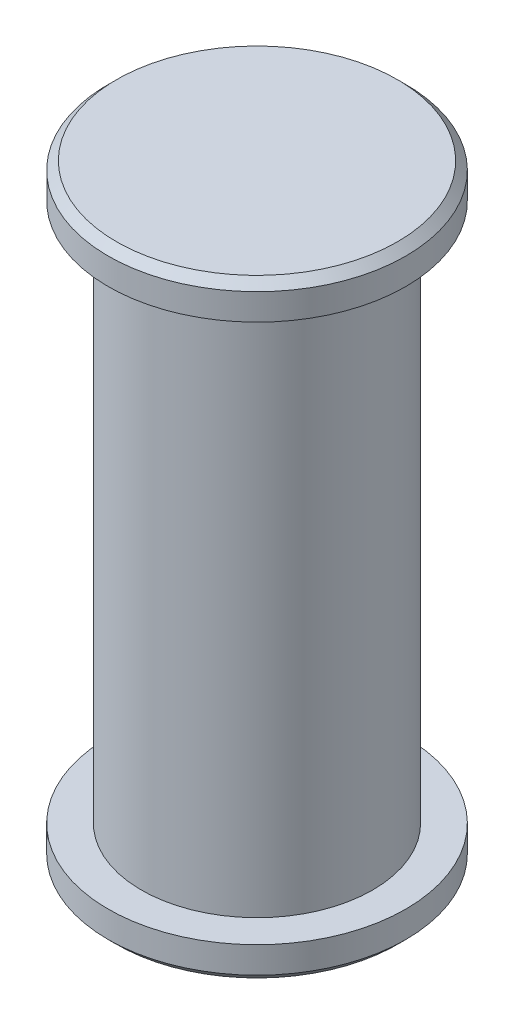
from build123d import *

# Parameters (mm, degrees)
CHAMFER1_SIZE = 0.25


with BuildPart() as part:
    # Sketch1 → Revolve1 (revolve)
    with BuildSketch(Plane.XY, mode=Mode.PRIVATE) as revolve1_sk:
        Polygon((0, 18.407826487), (-4.5, 18.407826487), (-4.5, 17.358913243), (-3.5, 17.358913243), (-3.5, 1.048913243), (-4.5, 1.048913243), (-4.5, 0), (0, 0), align=None)
    revolve(revolve1_sk.sketch.rotate(Axis((0, 0, 0), (0, 1, 0)), 180), axis=Axis((0, 0, 0), (0, 1, 0)))

    # Chamfer1
    chamfer1_edges = [part.edges().sort_by_distance(p)[0] for p in [
        (-4.5, 0, 0),
        (-4.5, 18.407826487, 0),
    ]]
    chamfer(chamfer1_edges, length=CHAMFER1_SIZE)


solid = part.part
